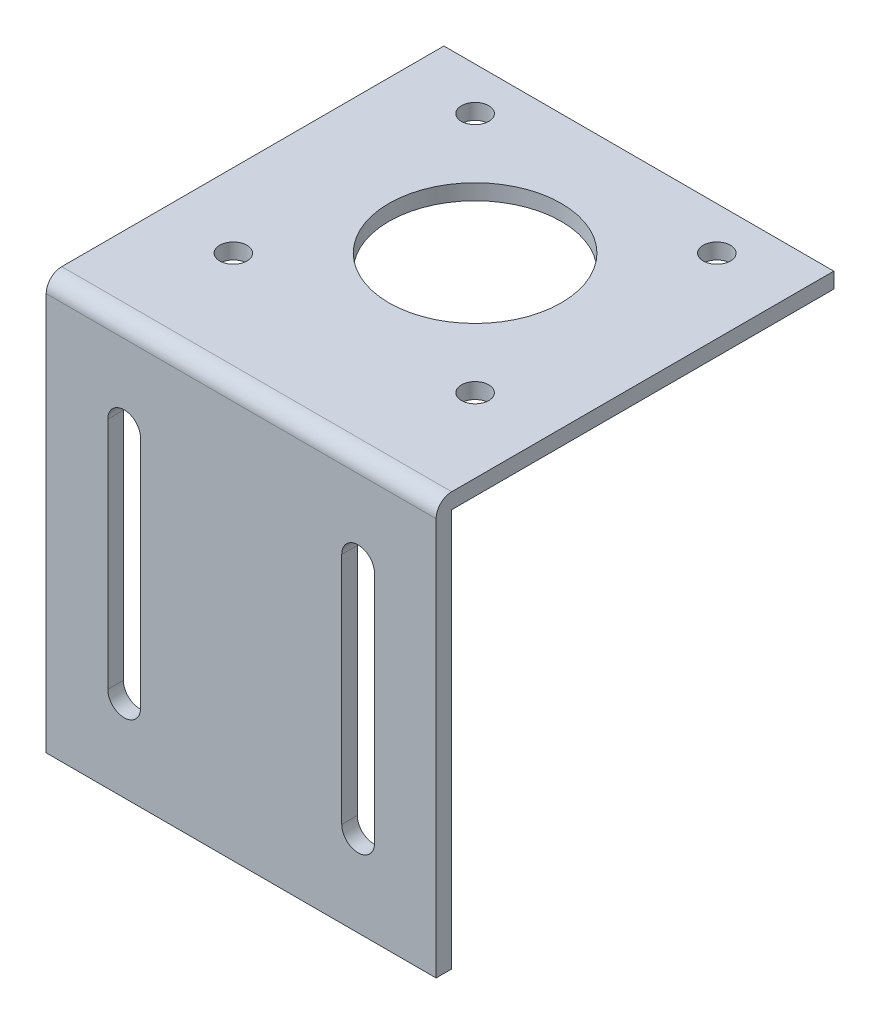
from build123d import *

# Parameters (mm, degrees)
SKETCH_1_W      = 50
SKETCH_1_H      = 49
SKETCH_1_R      = 11.05
SKETCH_1_R_2    = 1.75
EXTRUDE_1_DEPTH = 2
EXTRUDE_2_DEPTH = 2
FILLET_2_R      = 2


with BuildPart() as part:
    # 草图1 → 凸台-拉伸1 (new body)
    with BuildSketch(Plane(origin=(0, 0, 0), x_dir=(1, 0, 0), z_dir=(0, 1, 0))):
        with Locations((-25, 0)):
            Rectangle(SKETCH_1_W, SKETCH_1_H)
        with Locations(Location((-25, 3.5, 0), (0, 0, 270))):
            Circle(SKETCH_1_R, mode=Mode.SUBTRACT)
        with Locations(Location((-40.5, 19, 0), (0, 0, 270))):
            Circle(SKETCH_1_R_2, mode=Mode.SUBTRACT)
        with Locations(Location((-9.5, 19, 0), (0, 0, 270))):
            Circle(SKETCH_1_R_2, mode=Mode.SUBTRACT)
        with Locations(Location((-9.5, -12, 0), (0, 0, 270))):
            Circle(SKETCH_1_R_2, mode=Mode.SUBTRACT)
        with Locations(Location((-40.5, -12, 0), (0, 0, 270))):
            Circle(SKETCH_1_R_2, mode=Mode.SUBTRACT)
    extrude(amount=EXTRUDE_1_DEPTH)

    # 草图2 → 凸台-拉伸2 (add)
    with BuildSketch(Plane.XY.offset(24.5)):
        Polygon((0, 0), (0, -51), (-50, -51), (-50, 0), (-50, 2), (0, 2), align=None)
        with BuildLine():
            Line((-7.9, -10), (-7.9, -40))
            ThreePointArc((-7.9, -40), (-10, -42.1), (-12.1, -40))
            Line((-12.1, -40), (-12.1, -10))
            ThreePointArc((-12.1, -10), (-10, -7.9), (-7.9, -10))
        make_face(mode=Mode.SUBTRACT)
        with BuildLine():
            Line((-37.9, -10), (-37.9, -40))
            ThreePointArc((-37.9, -40), (-40, -42.1), (-42.1, -40))
            Line((-42.1, -40), (-42.1, -10))
            ThreePointArc((-42.1, -10), (-40, -7.9), (-37.9, -10))
        make_face(mode=Mode.SUBTRACT)
    extrude(amount=EXTRUDE_2_DEPTH)

    # 圆角2
    fillet_2_edges = [part.edges().sort_by_distance(p)[0] for p in [
        (-25, 2, 26.5),
    ]]
    fillet(fillet_2_edges, radius=FILLET_2_R)


solid = part.part
